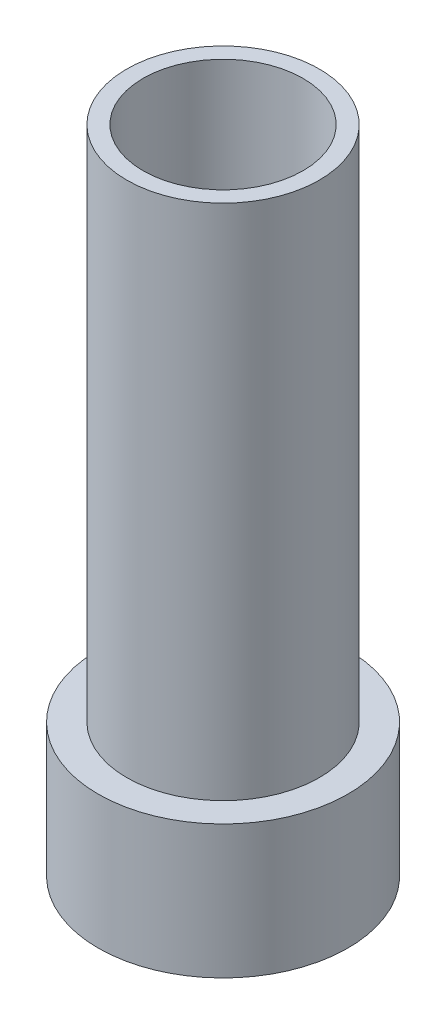
from build123d import *

# Parameters (mm, degrees)
SKETCH1_R           = 4.68
BOSS_EXTRUDE1_DEPTH = 5
SKETCH2_R           = 3.61
SKETCH2_R_2         = 3
BOSS_EXTRUDE2_DEPTH = 19.4
SKETCH3_R           = 3
BOSS_EXTRUDE4_DEPTH = 14.05


with BuildPart() as part:
    # Sketch1 → Boss-Extrude1 (new body)
    with BuildSketch(Plane(origin=(0, 0, 0), x_dir=(1, 0, 0), z_dir=(0, 1, 0))):
        with Locations(Location((0, 0, 0), (0, 0, 270))):
            Circle(SKETCH1_R)
    extrude(amount=BOSS_EXTRUDE1_DEPTH)

    # Sketch2 → Boss-Extrude2 (add)
    with BuildSketch(Plane(origin=(0, 5, 0), x_dir=(1, 0, 0), z_dir=(0, 1, 0))):
        with Locations(Location((0, 0, 0), (0, 0, 270))):
            Circle(SKETCH2_R)
        with Locations(Location((0, 0, 0), (0, 0, 270))):
            Circle(SKETCH2_R_2, mode=Mode.SUBTRACT)
    extrude(amount=BOSS_EXTRUDE2_DEPTH)

    # Sketch3 → Boss-Extrude4 (add)
    with BuildSketch(Plane(origin=(0, 5, 0), x_dir=(1, 0, 0), z_dir=(0, 1, 0))):
        with Locations(Location((0, 0, 0), (0, 0, 270))):
            Circle(SKETCH3_R)
    extrude(amount=BOSS_EXTRUDE4_DEPTH)


solid = part.part
